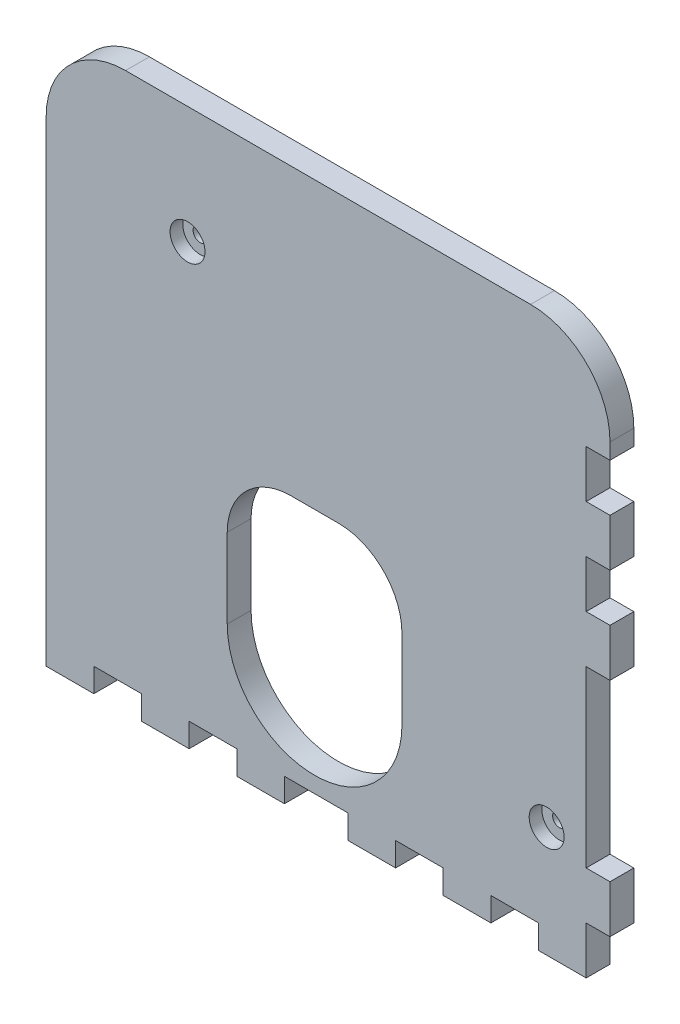
from build123d import *

# Parameters (mm, degrees)
SKETCH1_R           = 11
BOSS_EXTRUDE1_DEPTH = 15
SKETCH4_R           = 11
SKETCH4_R_2         = 4.5
BOSS_EXTRUDE4_DEPTH = 7
SKETCH5_R           = 11
SKETCH5_R_2         = 4.25
BOSS_EXTRUDE5_DEPTH = 7


with BuildPart() as part:
    # Sketch1 → Boss-Extrude1 (new body)
    with BuildSketch(Plane.XY):
        with BuildLine():
            Line((-120, 170), (135, 170))
            ThreePointArc((135, 170), (170.355339059, 155.355339059), (185, 120))
            Line((185, 120), (185, 110))
            Line((185, 110), (170, 110))
            Line((170, 110), (170, 80))
            Line((170, 80), (185, 80))
            Line((185, 80), (185, 50))
            Line((185, 50), (170, 50))
            Line((170, 50), (170, 20))
            Line((170, 20), (185, 20))
            Line((185, 20), (185, -10))
            Line((185, -10), (170, -10))
            Line((170, -10), (170, -119.800029128))
            Line((170, -119.800029128), (185, -119.800029128))
            Line((185, -119.800029128), (185, -149.800029128))
            Line((185, -149.800029128), (170, -149.800029128))
            Line((170, -149.800029128), (170, -179.800029128))
            Line((170, -179.800029128), (140, -179.800029128))
            Line((140, -179.800029128), (140, -164.8))
            Line((140, -164.8), (110, -164.8))
            Line((110, -164.8), (110, -179.8))
            Line((110, -179.8), (80, -179.8))
            Line((80, -179.8), (80, -164.8))
            Line((80, -164.8), (50, -164.8))
            Line((50, -164.8), (50, -179.8))
            Line((50, -179.8), (20, -179.8))
            Line((20, -179.8), (20, -164.8))
            Line((20, -164.8), (-20, -164.8))
            Line((-20, -164.8), (-20, -179.8))
            Line((-20, -179.8), (-50, -179.8))
            Line((-50, -179.8), (-50, -164.8))
            Line((-50, -164.8), (-80, -164.8))
            Line((-80, -164.8), (-80, -179.8))
            Line((-80, -179.8), (-110, -179.8))
            Line((-110, -179.8), (-110, -164.8))
            Line((-110, -164.8), (-140, -164.8))
            Line((-140, -164.8), (-140, -179.8))
            Line((-140, -179.8), (-170, -179.8))
            Line((-170, -179.8), (-170, -170))
            Line((-170, -170), (-170, 120))
            ThreePointArc((-170, 120), (-155.355339059, 155.355339059), (-120, 170))
        make_face()
        with Locations((145.104779776, -110)):
            Circle(SKETCH1_R, mode=Mode.SUBTRACT)
        with Locations((-81, 96.144292568)):
            Circle(SKETCH1_R, mode=Mode.SUBTRACT)
        with BuildLine():
            Line((-55.995398281, -49.8), (-55.995398281, -99.8))
            ThreePointArc((-55.995398281, -99.8), (-0.995398281, -154.8), (54.004601719, -99.8))
            Line((54.004601719, -99.8), (54.004601719, -49.8))
            ThreePointArc((54.004601719, -49.8), (42.288872967, -21.515728753), (14.004601719, -9.8))
            Line((14.004601719, -9.8), (-15.995398281, -9.8))
            ThreePointArc((-15.995398281, -9.8), (-44.279669528, -21.515728753), (-55.995398281, -49.8))
        make_face(mode=Mode.SUBTRACT)
    extrude(amount=BOSS_EXTRUDE1_DEPTH)

    # Sketch5 → Boss-Extrude5 (add)
    with BuildSketch(Plane(origin=(0, 0, 0), x_dir=(-1, 0, 0), z_dir=(0, 0, -1))):
        with Locations((-145.104779776, -110)):
            Circle(SKETCH5_R)
        with Locations((-145.104779776, -110)):
            Circle(SKETCH5_R_2, mode=Mode.SUBTRACT)
    extrude(amount=-BOSS_EXTRUDE5_DEPTH)


with BuildPart() as body_2:
    # Sketch4 → Boss-Extrude4 (new body)
    with BuildSketch(Plane(origin=(0, 0, 0), x_dir=(-1, 0, 0), z_dir=(0, 0, -1))):
        with Locations((81, 96.144292568)):
            Circle(SKETCH4_R)
        with Locations((81, 96.144292568)):
            Circle(SKETCH4_R_2, mode=Mode.SUBTRACT)
    extrude(amount=-BOSS_EXTRUDE4_DEPTH)


solid = Compound([part.part, body_2.part])
